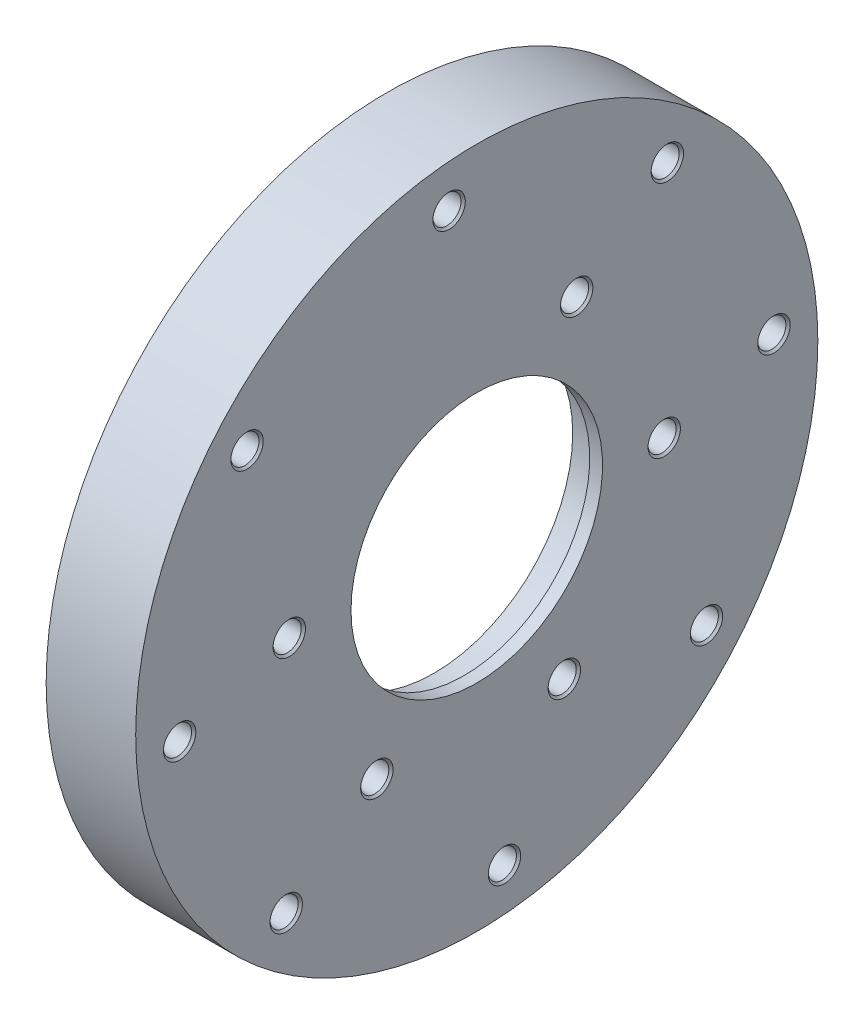
from build123d import *

# Parameters (mm, degrees)
SKETCH3_R          = 2.5
CUT_EXTRUDE1_DEPTH = 4
SKETCH6_R          = 3
CUT_EXTRUDE4_DEPTH = 11
SKETCH7_R          = 3.3
CUT_EXTRUDE5_DEPTH = 10
SKETCH9_R          = 1
CUT_EXTRUDE7_DEPTH = 2
CUT_EXTRUDE8_REACH = 117.07
SKETCH10_R         = 3.3
CHAMFER1_SIZE      = 0.5


with BuildPart() as part:
    # Sketch2 → Revolve1 (revolve)
    with BuildSketch(Plane.XY, mode=Mode.PRIVATE) as revolve1_sk:
        Polygon((0, 80), (0, 52.5), (11, 52.5), (11, 32.5), (18, 32.5), (18, 29.5), (21, 29.5), (21, 80), align=None)
    revolve(revolve1_sk.sketch.rotate(Axis((0, 0, 0), (1, 0, 0)), 90), axis=Axis((0, 0, 0), (1, 0, 0)))

    # Sketch3 → Cut-Extrude1 (cut)
    with BuildSketch(Plane.ZY):
        with Locations((0, 60)):
            Circle(SKETCH3_R)
        with Locations((12.077911205, 58.771796475)):
            Circle(SKETCH3_R)
        with Locations((23.661351307, 55.137468697)):
            Circle(SKETCH3_R)
        with Locations((34.276092906, 49.245806472)):
            Circle(SKETCH3_R)
        with Locations((43.487567234, 41.338015145)):
            Circle(SKETCH3_R)
        with Locations((50.91865545, 31.73784062)):
            Circle(SKETCH3_R)
        with Locations((56.265127929, 20.838315171)):
            Circle(SKETCH3_R)
        with Locations((59.30809946, 9.08566665)):
            Circle(SKETCH3_R)
        with Locations((59.92299043, -3.03895013)):
            Circle(SKETCH3_R)
        with Locations((58.084627132, -15.039151936)):
            Circle(SKETCH3_R)
        with Locations((53.868272374, -26.423649093)):
            Circle(SKETCH3_R)
        with Locations((47.446544216, -36.726358953)):
            Circle(SKETCH3_R)
        with Locations((39.082348963, -45.525487362)):
            Circle(SKETCH3_R)
        with Locations((29.118117752, -52.460796969)):
            Circle(SKETCH3_R)
        with Locations((17.961787378, -57.248355384)):
            Circle(SKETCH3_R)
        with Locations((6.070099319, -59.692159404)):
            Circle(SKETCH3_R)
        with Locations((-6.070099319, -59.692159404)):
            Circle(SKETCH3_R)
        with Locations((-17.961787378, -57.248355384)):
            Circle(SKETCH3_R)
        with Locations((-29.118117752, -52.460796969)):
            Circle(SKETCH3_R)
        with Locations((-39.082348963, -45.525487362)):
            Circle(SKETCH3_R)
        with Locations((-47.446544216, -36.726358953)):
            Circle(SKETCH3_R)
        with Locations((-53.868272374, -26.423649093)):
            Circle(SKETCH3_R)
        with Locations((-58.084627132, -15.039151936)):
            Circle(SKETCH3_R)
        with Locations((-59.92299043, -3.03895013)):
            Circle(SKETCH3_R)
        with Locations((-59.30809946, 9.08566665)):
            Circle(SKETCH3_R)
        with Locations((-56.265127929, 20.838315171)):
            Circle(SKETCH3_R)
        with Locations((-50.91865545, 31.73784062)):
            Circle(SKETCH3_R)
        with Locations((-43.487567234, 41.338015145)):
            Circle(SKETCH3_R)
        with Locations((-34.276092906, 49.245806472)):
            Circle(SKETCH3_R)
        with Locations((-23.661351307, 55.137468697)):
            Circle(SKETCH3_R)
        with Locations((-12.077911205, 58.771796475)):
            Circle(SKETCH3_R)
    extrude(amount=-CUT_EXTRUDE1_DEPTH, mode=Mode.SUBTRACT)

    # Sketch6 → Cut-Extrude4 (cut)
    with BuildSketch(Plane.ZY):
        with Locations((53.875586653, 44.692517973)):
            Circle(SKETCH6_R)
        with Locations((69.69817519, -6.493410136)):
            Circle(SKETCH6_R)
        with Locations((44.692517973, -53.875586653)):
            Circle(SKETCH6_R)
        with Locations((-6.493410136, -69.69817519)):
            Circle(SKETCH6_R)
        with Locations((-53.875586653, -44.692517973)):
            Circle(SKETCH6_R)
        with Locations((-69.69817519, 6.493410136)):
            Circle(SKETCH6_R)
        with Locations((-44.692517973, 53.875586653)):
            Circle(SKETCH6_R)
        with Locations((6.493410136, 69.69817519)):
            Circle(SKETCH6_R)
    extrude(amount=-CUT_EXTRUDE4_DEPTH, mode=Mode.SUBTRACT)

    # Sketch7 → Cut-Extrude5 (cut)
    with BuildSketch(Plane.ZY.offset(-21)):
        with Locations((53.875586653, 44.692517973)):
            Circle(SKETCH7_R)
        with Locations((69.69817519, -6.493410136)):
            Circle(SKETCH7_R)
        with Locations((44.692517973, -53.875586653)):
            Circle(SKETCH7_R)
        with Locations((-6.493410136, -69.69817519)):
            Circle(SKETCH7_R)
        with Locations((-53.875586653, -44.692517973)):
            Circle(SKETCH7_R)
        with Locations((-69.69817519, 6.493410136)):
            Circle(SKETCH7_R)
        with Locations((-44.692517973, 53.875586653)):
            Circle(SKETCH7_R)
        with Locations((6.493410136, 69.69817519)):
            Circle(SKETCH7_R)
    extrude(amount=CUT_EXTRUDE5_DEPTH, mode=Mode.SUBTRACT)

    # Sketch9 → Cut-Extrude7 (cut)
    with BuildSketch(Plane.ZY):
        with Locations((2.51770285, -71.46627686)):
            Circle(SKETCH9_R)
    extrude(amount=-CUT_EXTRUDE7_DEPTH, mode=Mode.SUBTRACT)

    # Sketch10 → Cut-Extrude8 (cut, up to next)
    with BuildSketch(Plane(origin=(21, 0, 0), x_dir=(0, 0, -1), z_dir=(1, 0, 0)), mode=Mode.PRIVATE) as cut_extrude8_sk1:
        with Locations((23.431880753, 37.241736861)):
            Circle(SKETCH10_R)
    cut_extrude8_tool1 = extrude(cut_extrude8_sk1.sketch, amount=-CUT_EXTRUDE8_REACH, mode=Mode.PRIVATE) & part.part
    # Sketch10 → Cut-Extrude8 (cut, up to next)
    with BuildSketch(Plane(origin=(21, 0, 0), x_dir=(0, 0, -1), z_dir=(1, 0, 0)), mode=Mode.PRIVATE) as cut_extrude8_sk2:
        with Locations((20.536349826, -38.913472421)):
            Circle(SKETCH10_R)
    cut_extrude8_tool2 = extrude(cut_extrude8_sk2.sketch, amount=-CUT_EXTRUDE8_REACH, mode=Mode.PRIVATE) & part.part
    # Sketch10 → Cut-Extrude8 (cut, up to next)
    with BuildSketch(Plane(origin=(21, 0, 0), x_dir=(0, 0, -1), z_dir=(1, 0, 0)), mode=Mode.PRIVATE) as cut_extrude8_sk3:
        with Locations((-43.968230579, 1.67173556)):
            Circle(SKETCH10_R)
    cut_extrude8_tool3 = extrude(cut_extrude8_sk3.sketch, amount=-CUT_EXTRUDE8_REACH, mode=Mode.PRIVATE) & part.part
    # Sketch10 → Cut-Extrude8 (cut, up to next)
    with BuildSketch(Plane(origin=(21, 0, 0), x_dir=(0, 0, -1), z_dir=(1, 0, 0)), mode=Mode.PRIVATE) as cut_extrude8_sk4:
        with Locations((-23.431880753, -37.241736861)):
            Circle(SKETCH10_R)
    cut_extrude8_tool4 = extrude(cut_extrude8_sk4.sketch, amount=-CUT_EXTRUDE8_REACH, mode=Mode.PRIVATE) & part.part
    # Sketch10 → Cut-Extrude8 (cut, up to next)
    with BuildSketch(Plane(origin=(21, 0, 0), x_dir=(0, 0, -1), z_dir=(1, 0, 0)), mode=Mode.PRIVATE) as cut_extrude8_sk5:
        with Locations((43.968230579, -1.67173556)):
            Circle(SKETCH10_R)
    cut_extrude8_tool5 = extrude(cut_extrude8_sk5.sketch, amount=-CUT_EXTRUDE8_REACH, mode=Mode.PRIVATE) & part.part
    add(cut_extrude8_tool1.solids().sort_by_distance((21, 37.241737, -23.431881))[0], mode=Mode.SUBTRACT)
    add(cut_extrude8_tool2.solids().sort_by_distance((21, -38.913472, -20.53635))[0], mode=Mode.SUBTRACT)
    add(cut_extrude8_tool3.solids().sort_by_distance((21, 1.671736, 43.968231))[0], mode=Mode.SUBTRACT)
    add(cut_extrude8_tool4.solids().sort_by_distance((21, -37.241737, 23.431881))[0], mode=Mode.SUBTRACT)
    add(cut_extrude8_tool5.solids().sort_by_distance((21, -1.671736, -43.968231))[0], mode=Mode.SUBTRACT)

    # Chamfer1
    chamfer1_edges = [part.edges().sort_by_distance(p)[0] for p in [
        (21, 53.875586653, -47.992517973),
        (21, -6.493410136, 66.39817519),
        (21, -53.875586653, 41.392517973),
        (21, -69.69817519, -9.793410136),
        (21, -44.692517973, -57.175586653),
        (21, 6.493410136, -72.99817519),
        (21, 69.69817519, 3.193410136),
        (21, 44.692517973, 50.575586653),
        (21, 37.241736861, -20.131880753),
        (21, -1.67173556, -40.668230579),
        (21, -38.913472421, -17.236349826),
        (21, 1.67173556, 47.268230579),
        (21, -37.241736861, 26.731880753),
    ]]
    chamfer(chamfer1_edges, length=CHAMFER1_SIZE)


solid = part.part
